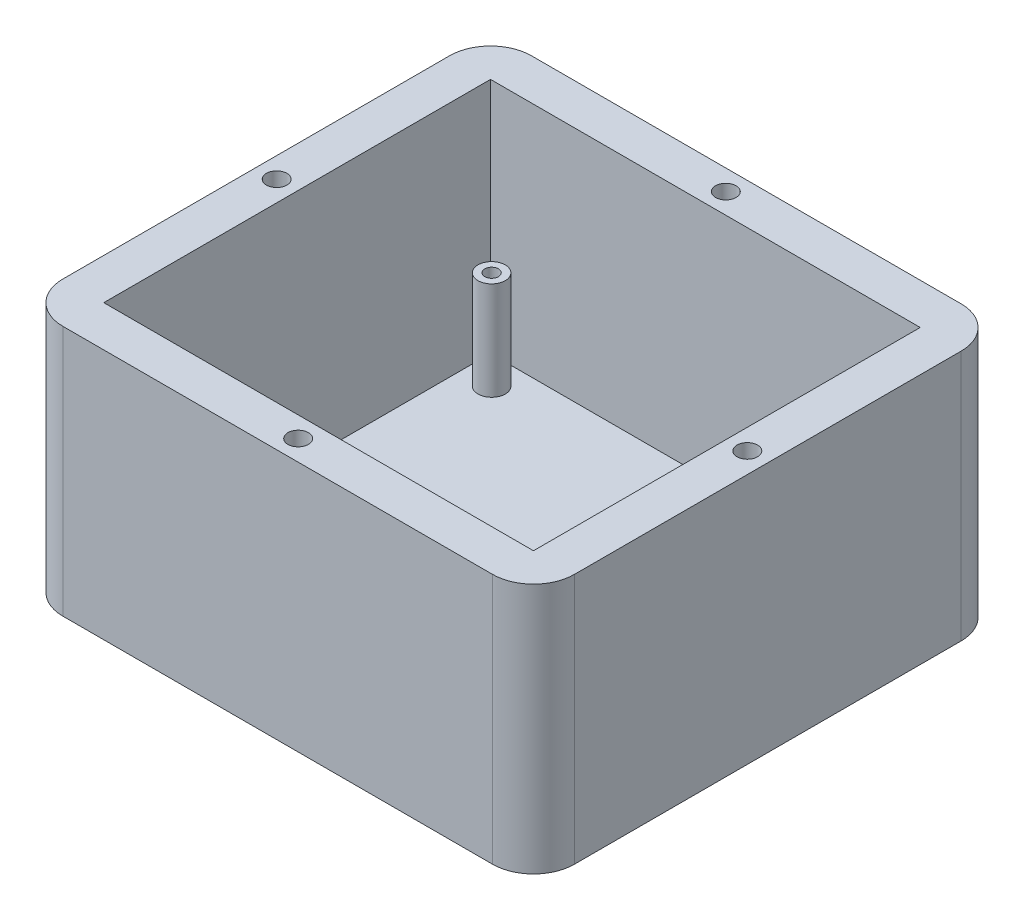
from build123d import *

# Parameters (mm, degrees)
BOSS_EXTRUDE1_DEPTH = 58.42
SKETCH3_W           = 99.999999898
SKETCH3_H           = 90.000000086
CUT_EXTRUDE1_DEPTH  = 55.245
SKETCH5_R           = 3.175
SKETCH5_R_2         = 1.5875
BOSS_EXTRUDE2_DEPTH = 22.86
BOSS_EXTRUDE3_DEPTH = 58.42
SKETCH8_R           = 2.38125
CUT_EXTRUDE2_DEPTH  = 12.7


with BuildPart() as part:
    # Sketch1 → Boss-Extrude1 (new body)
    with BuildSketch(Plane(origin=(0, 0, 0), x_dir=(1, 0, 0), z_dir=(0, 1, 0))):
        with BuildLine():
            Line((3.175, 0), (103.174999898, 0))
            ThreePointArc((103.174999898, 0), (105.420063928, 0.92993597), (106.349999898, 3.175))
            Line((106.349999898, 3.175), (106.349999898, 93.175000086))
            ThreePointArc((106.349999898, 93.175000086), (105.420063928, 95.420064116), (103.174999898, 96.350000086))
            Line((103.174999898, 96.350000086), (3.175, 96.350000086))
            ThreePointArc((3.175, 96.350000086), (0.92993597, 95.420064116), (0, 93.175000086))
            Line((0, 93.175000086), (0, 3.175))
            ThreePointArc((0, 3.175), (0.92993597, 0.92993597), (3.175, 0))
        make_face()
    extrude(amount=BOSS_EXTRUDE1_DEPTH)

    # Sketch3 → Cut-Extrude1 (cut)
    with BuildSketch(Plane(origin=(0, 58.42, 0), x_dir=(1, 0, 0), z_dir=(0, 1, 0))):
        with Locations((53.174999949, 48.175000043)):
            Rectangle(SKETCH3_W, SKETCH3_H)
    extrude(amount=-CUT_EXTRUDE1_DEPTH, mode=Mode.SUBTRACT)

    # Sketch5 → Boss-Extrude2 (add)
    # profile 1 of 2: a face of its own
    with BuildSketch(Plane(origin=(0, 3.175, 0), x_dir=(1, 0, 0), z_dir=(0, 1, 0))):
        with Locations(Location((66.303499949, 10.055000043, 0), (0, 0, 270))):
            Circle(SKETCH5_R)
        with Locations(Location((66.303499949, 10.055000043, 0), (0, 0, 270))):
            Circle(SKETCH5_R_2, mode=Mode.SUBTRACT)
    # profile 2 of 2: a face of its own
    with BuildSketch(Plane(origin=(0, 3.175, 0), x_dir=(1, 0, 0), z_dir=(0, 1, 0))):
        with Locations(Location((9.890999949, 86.717500043, 0), (0, 0, 270))):
            Circle(SKETCH5_R)
        with Locations(Location((9.890999949, 86.717500043, 0), (0, 0, 270))):
            Circle(SKETCH5_R_2, mode=Mode.SUBTRACT)
    extrude(amount=BOSS_EXTRUDE2_DEPTH)

    # Sketch7 → Boss-Extrude3 (add)
    with BuildSketch(Plane.XZ):
        with BuildLine():
            Line((3.175, -102.700000086), (103.174999898, -102.700000086))
            ThreePointArc((103.174999898, -102.700000086), (109.910191989, -99.910192177), (112.699999898, -93.175000086))
            Line((112.699999898, -93.175000086), (112.699999898, -3.175))
            ThreePointArc((112.699999898, -3.175), (109.910191989, 3.560192091), (103.174999898, 6.35))
            Line((103.174999898, 6.35), (3.175, 6.35))
            ThreePointArc((3.175, 6.35), (-3.560192091, 3.560192091), (-6.35, -3.175))
            Line((-6.35, -3.175), (-6.35, -93.175000086))
            ThreePointArc((-6.35, -93.175000086), (-3.560192091, -99.910192177), (3.175, -102.700000086))
        make_face()
        with BuildLine():
            Line((3.175, -96.350000086), (103.174999898, -96.350000086))
            ThreePointArc((103.174999898, -96.350000086), (105.420063928, -95.420064116), (106.349999898, -93.175000086))
            Line((106.349999898, -93.175000086), (106.349999898, -3.175))
            ThreePointArc((106.349999898, -3.175), (105.420063928, -0.92993597), (103.174999898, 0))
            Line((103.174999898, 0), (3.175, 0))
            ThreePointArc((3.175, 0), (0.92993597, -0.92993597), (0, -3.175))
            Line((0, -3.175), (0, -93.175000086))
            ThreePointArc((0, -93.175000086), (0.92993597, -95.420064116), (3.175, -96.350000086))
        make_face(mode=Mode.SUBTRACT)
    extrude(amount=-BOSS_EXTRUDE3_DEPTH)

    # Sketch8 → Cut-Extrude2 (cut)
    with BuildSketch(Plane(origin=(0, 58.42, 0), x_dir=(1, 0, 0), z_dir=(0, 1, 0))):
        with Locations(Location((-1.5875, 48.175000043, 0), (0, 0, 270))):
            Circle(SKETCH8_R)
        with Locations(Location((53.174999949, 97.937500086, 0), (0, 0, 270))):
            Circle(SKETCH8_R)
        with Locations(Location((107.937499898, 48.175000043, 0), (0, 0, 90))):
            Circle(SKETCH8_R)
        with Locations(Location((53.174999949, -1.5875, 0), (0, 0, 90))):
            Circle(SKETCH8_R)
    extrude(amount=-CUT_EXTRUDE2_DEPTH, mode=Mode.SUBTRACT)


solid = part.part
